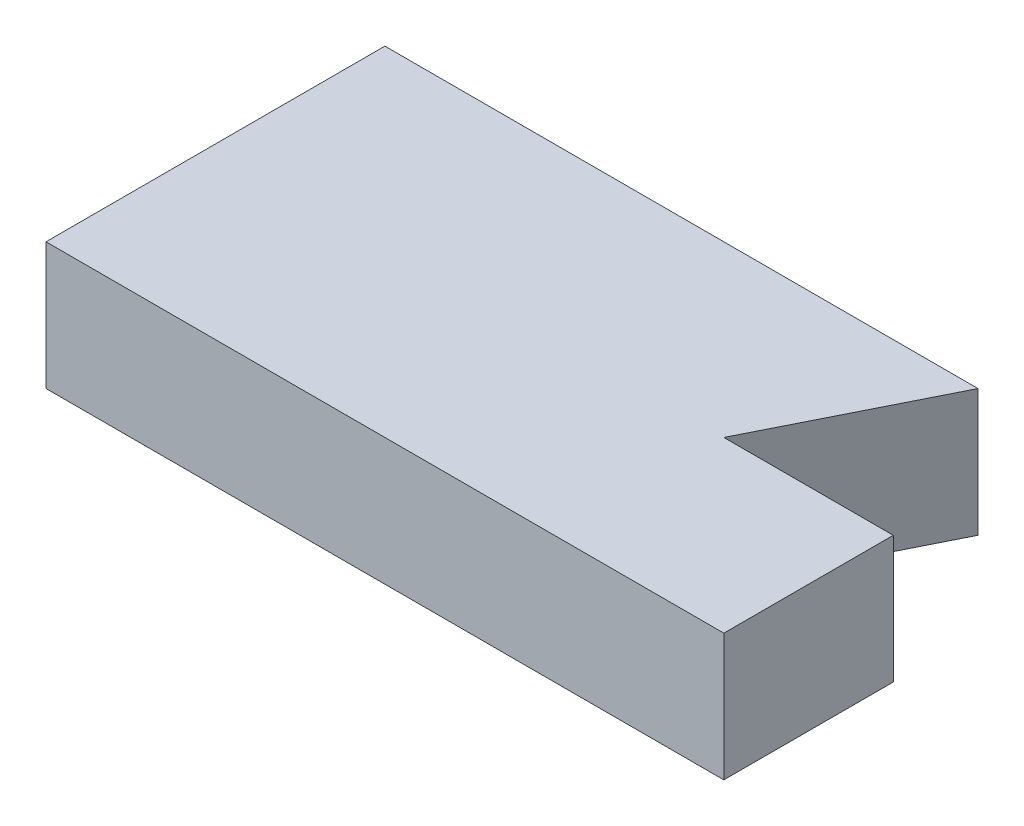
from build123d import *

# Parameters (mm, degrees)
BOSS_EXTRUDE1_DEPTH = 15


with BuildPart() as part:
    # Sketch1 → Boss-Extrude1 (new body)
    with BuildSketch(Plane(origin=(0, 0, 0), x_dir=(1, 0, 0), z_dir=(0, 1, 0))):
        Polygon((0, 0), (80, 0), (80, 20), (60, 20), (70, 40), (0, 40), align=None)
    extrude(amount=BOSS_EXTRUDE1_DEPTH)


solid = part.part
